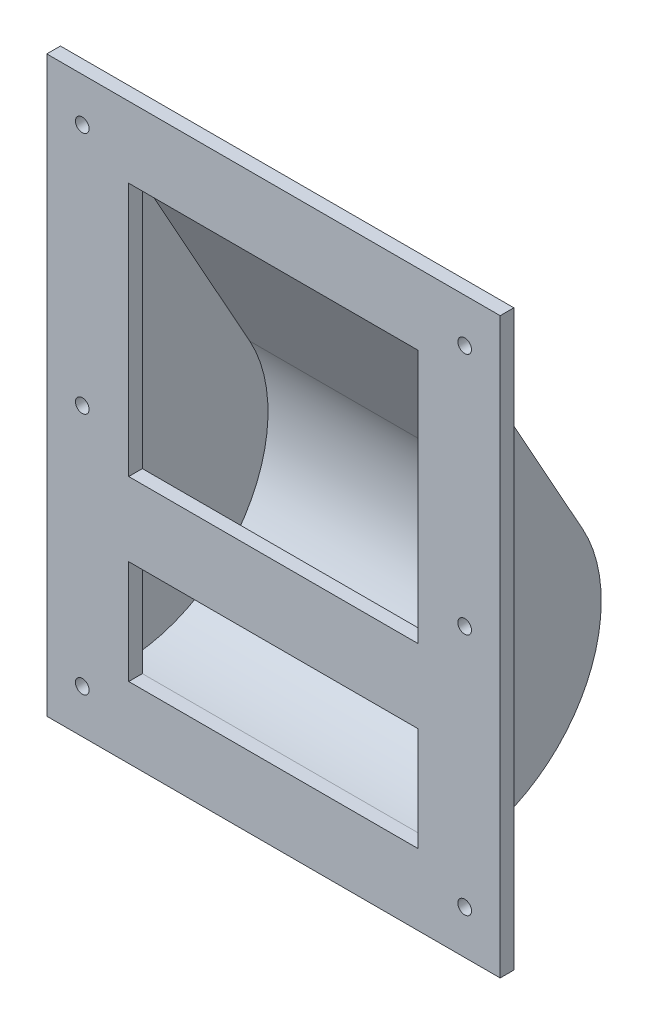
from build123d import *

# Parameters (mm, degrees)
EXTRU_MINCE1_DEPTH      = 60
BOSS_EXTRU_1_START      = 1
BOSS_EXTRU_1_DEPTH      = 1
BOSS_EXTRU_2_DEPTH      = 1
ESQUISSE4_W             = 166
ESQUISSE4_H             = 210
ESQUISSE4_W_2           = 106
ESQUISSE4_H_2           = 93
ESQUISSE4_H_3           = 38
BOSS_EXTRU_3_DEPTH      = 5
ESQUISSE5_R             = 2.5
ENL_V_MAT_EXTRU_1_DEPTH = 166.924681708


with BuildPart() as part:
    # Esquisse1 → Extru.-Mince1 (new, symmetric)
    with BuildSketch(Plane(origin=(0, 0, 0), x_dir=(0, 0, -1), z_dir=(1, 0, 0))):
        with BuildLine():
            ThreePointArc((0, -54), (46.554240379, -27.362432324), (47.179157474, 26.27027027))
            Line((47.179157474, 26.27027027), (0, 111))
            Line((0, 111), (-0.873688101, 110.513513514))
            Line((-0.873688101, 110.513513514), (46.305469372, 25.783783784))
            ThreePointArc((46.305469372, 25.783783784), (45.692124817, -26.855720615), (0, -53))
            Line((0, -53), (0, -54))
        make_face()
    extrude(amount=EXTRU_MINCE1_DEPTH, both=True)

    # Esquisse2 → Boss.-Extru.1 (add)
    with BuildSketch(Plane(origin=(60, 0, 0), x_dir=(0, 0, -1), z_dir=(1, 0, 0)).offset(BOSS_EXTRU_1_START)):
        with BuildLine():
            Line((0, 111), (0, -54))
            ThreePointArc((0, -54), (46.554240379, -27.362432324), (47.179157474, 26.27027027))
            Line((47.179157474, 26.27027027), (0, 111))
        make_face()
    extrude(amount=-BOSS_EXTRU_1_DEPTH)

    # Esquisse3 → Boss.-Extru.2 (add)
    with BuildSketch(Plane.ZY.offset(60)):
        with BuildLine():
            Line((0, 111), (0, -54))
            ThreePointArc((0, -54), (-46.554240379, -27.362432324), (-47.179157474, 26.27027027))
            Line((-47.179157474, 26.27027027), (0, 111))
        make_face()
    extrude(amount=BOSS_EXTRU_2_DEPTH)

    # Esquisse4 → Boss.-Extru.3 (add)
    with BuildSketch(Plane.XY):
        with Locations((0, 26)):
            Rectangle(ESQUISSE4_W, ESQUISSE4_H)
        with Locations((0, 58.5)):
            Rectangle(ESQUISSE4_W_2, ESQUISSE4_H_2, mode=Mode.SUBTRACT)
        with Locations((0, -34)):
            Rectangle(ESQUISSE4_W_2, ESQUISSE4_H_3, mode=Mode.SUBTRACT)
    extrude(amount=BOSS_EXTRU_3_DEPTH)

    # Esquisse5 → Enlèv. mat.-Extru.1 (cut, through all)
    with BuildSketch(Plane.XY.offset(5)):
        with Locations((-70, 115)):
            Circle(ESQUISSE5_R)
        with Locations((-70, 26)):
            Circle(ESQUISSE5_R)
        with Locations((-70, -63)):
            Circle(ESQUISSE5_R)
        with Locations((70, -63)):
            Circle(ESQUISSE5_R)
        with Locations((70, 26)):
            Circle(ESQUISSE5_R)
        with Locations((70, 115)):
            Circle(ESQUISSE5_R)
    extrude(amount=-ENL_V_MAT_EXTRU_1_DEPTH, mode=Mode.SUBTRACT)


solid = part.part
